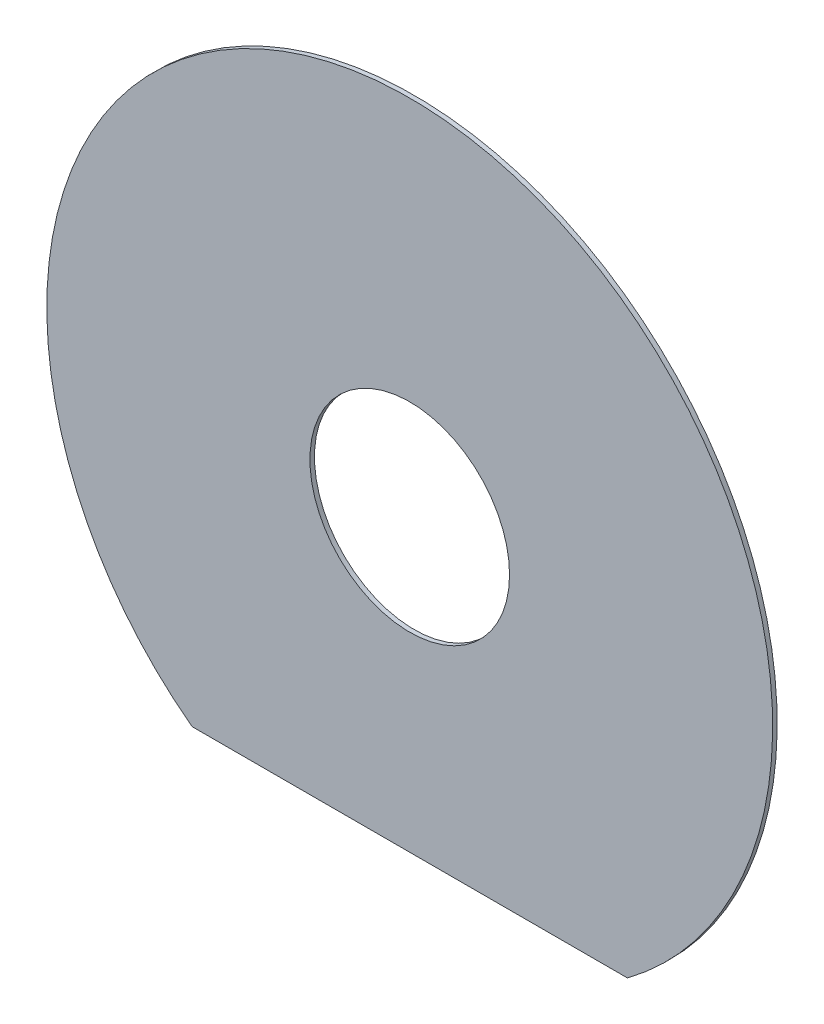
from build123d import *

# Parameters (mm, degrees)
SKETCH2_R           = 69.85
BOSS_EXTRUDE1_DEPTH = 3.175


with BuildPart() as part:
    # Sketch2 → Boss-Extrude1 (new body)
    with BuildSketch(Plane.XY):
        with BuildLine():
            Line((-152.4, -203.2), (152.4, -203.2))
            ThreePointArc((152.4, -203.2), (0, 254), (-152.4, -203.2))
        make_face()
        Circle(SKETCH2_R, mode=Mode.SUBTRACT)
    extrude(amount=BOSS_EXTRUDE1_DEPTH)


solid = part.part
